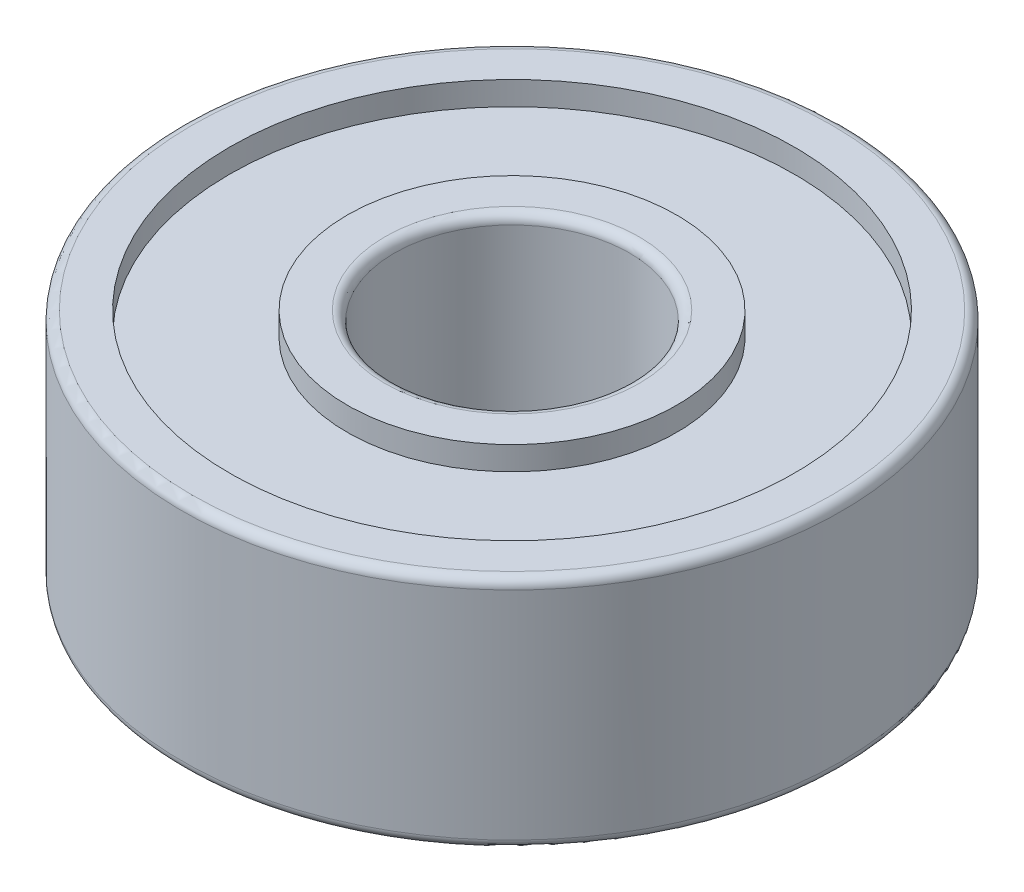
from build123d import *

# Parameters (mm, degrees)
FILLET1_R = 0.2


with BuildPart() as part:
    # Sketch1 → Revolve1 (revolve)
    with BuildSketch(Plane.XY):
        Polygon((-2.5, 0), (-3.5, 0), (-3.5, 0.5), (-6, 0.5), (-6, 0), (-7, 0), (-7, 5), (-6, 5), (-6, 4.5), (-3.5, 4.5), (-3.5, 5), (-2.5, 5), align=None)
    revolve(axis=Axis((0, 5, 0), (0, -1, 0)))

    # Fillet1
    fillet1_edges = [part.edges().sort_by_distance(p)[0] for p in [
        (7, 5, 0),
        (7, 0, 0),
        (2.5, 0, 0),
        (2.5, 5, 0),
    ]]
    fillet(fillet1_edges, radius=FILLET1_R)


solid = part.part
